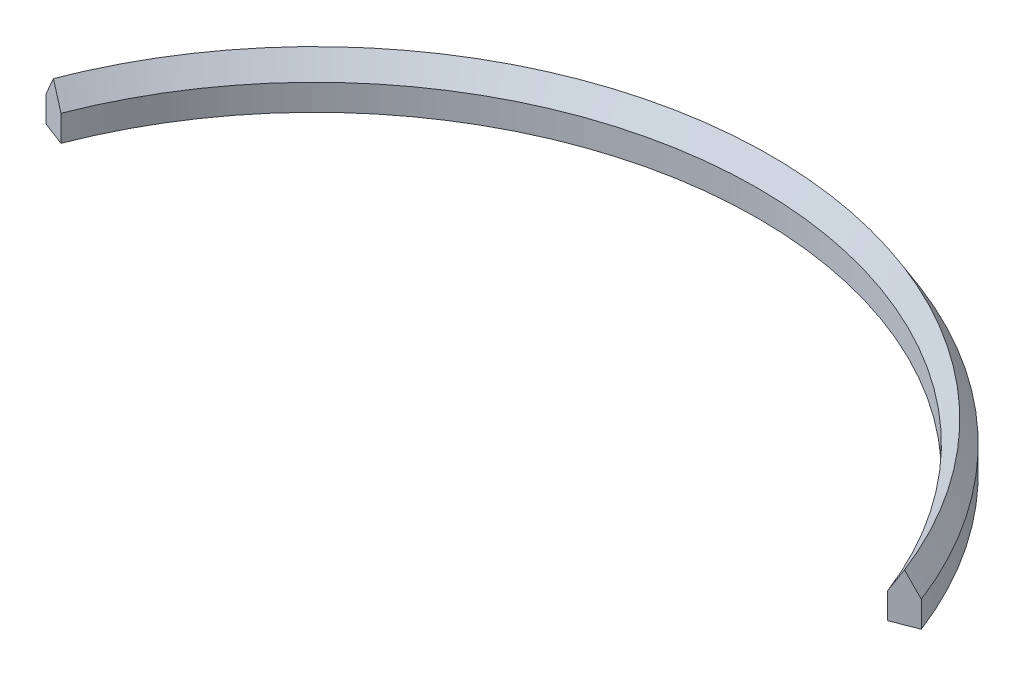
from build123d import *


with BuildPart() as part:
    # Sweep1: sweep along a path in PropShadow
    with BuildLine(Plane(origin=(0, 0, 0), x_dir=(1, 0, 0), z_dir=(0, 1, 0))) as sweep1_path:
        ThreePointArc((39.25, 15.138227876), (0, 42.068140478), (-39.25, 15.138227876))
    # Sketch4 → Sweep1 (sweep)
    with BuildSketch(Plane(origin=(0, 0, 0), x_dir=(0.9330101010986988, 0, 0.3598501788908768), z_dir=(-0.3598501788908768, 0, 0.9330101010986988))):
        Polygon((-43.268140478, 1.2), (-42.068140478, 3.2), (-40.868140478, 1.2), (-40.868140478, -1.2), (-43.268140478, -1.2), align=None)
    sweep(path=sweep1_path.line)


solid = part.part
